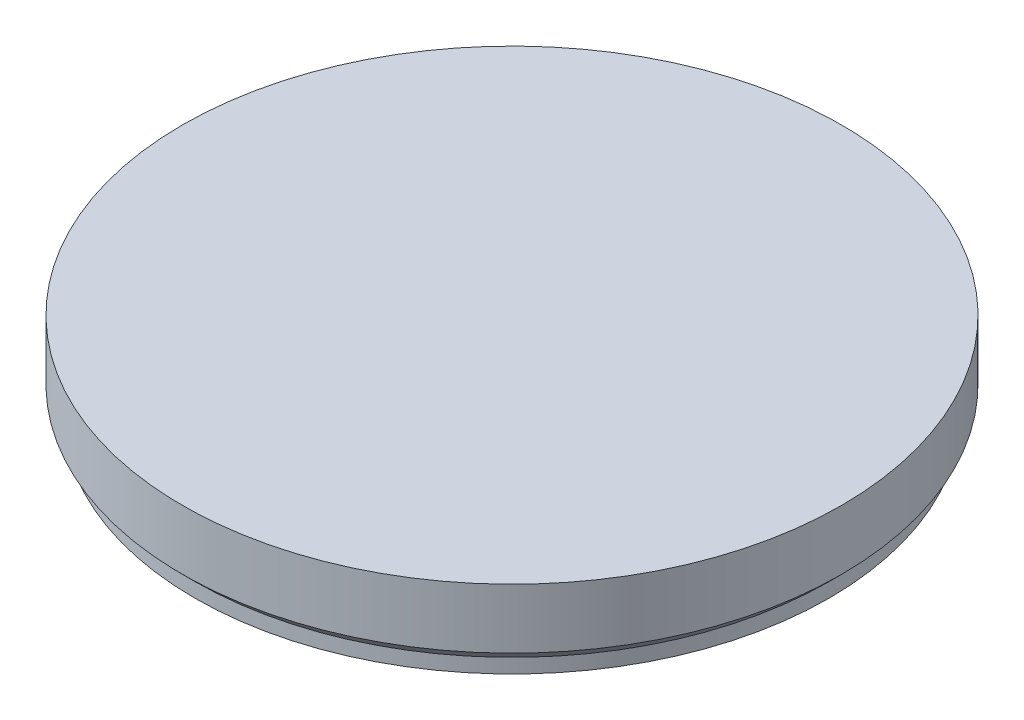
from build123d import *

# Parameters (mm, degrees)
SKETCH2_R            = 71
BOSS_EXTRUDE1_DEPTH  = 11
SKETCH12_R           = 57.5
SKETCH12_R_2         = 23.75
CUT_EXTRUDE8_DEPTH   = 1
CUT_EXTRUDE9_START   = -10
SKETCH10_R           = 85
SKETCH10_R_2         = 81
CUT_EXTRUDE9_DEPTH   = 10
SKETCH14_R           = 57.5
SKETCH14_R_2         = 23.75
BOSS_EXTRUDE2_DEPTH  = 1
SKETCH15_R           = 81
BOSS_EXTRUDE3_DEPTH  = 4
SKETCH16_R           = 57.5
SKETCH16_R_2         = 23.75
CUT_EXTRUDE11_DEPTH  = 2
SKETCH17_W           = 29
SKETCH17_H           = 10.11
SKETCH17_H_2         = 35.11
BOSS_EXTRUDE4_DEPTH  = 3
SKETCH19_R           = 80.970867582
BOSS_EXTRUDE5_DEPTH  = 2
BOSS_EXTRUDE6_START  = -3
SKETCH20_R           = 80.970867582
BOSS_EXTRUDE6_DEPTH  = 3
SKETCH21_W           = 29
SKETCH21_H           = 45.22
BOSS_EXTRUDE7_DEPTH  = 4
BOSS_EXTRUDE9_DEPTH  = 5
CUT_EXTRUDE12_START  = -5
SKETCH26_R           = 80.970867582
CUT_EXTRUDE12_DEPTH  = 5
BOSS_EXTRUDE10_START = -4
SKETCH27_R           = 80.970867582
BOSS_EXTRUDE10_DEPTH = 4
CUT_EXTRUDE15_REACH  = 120.043
SKETCH28_R           = 80.970867582
SKETCH28_R_2         = 80


with BuildPart() as part:
    # Sketch1 → Revolve1 (revolve)
    with BuildSketch(Plane.XY, mode=Mode.PRIVATE) as revolve1_sk:
        Polygon((0, 12), (0, 15), (85, 15), (85, 10.5), (84, 10.5), (77, 3.5), (77, 0), (71, 0), (71, 12), (23.75, 12), (23.75, -7.5), (21.25, -7.5), (21.25, 6), (6.5, 6), (6.5, 9), (0, 9), align=None)
    revolve(revolve1_sk.sketch.rotate(Axis((0, 12, 0), (0, -1, 0)), 180), axis=Axis((0, 12, 0), (0, -1, 0)))

    # Sketch2 → Boss-Extrude1 (add)
    with BuildSketch(Plane.XZ.offset(-12)):
        with Locations(Location((0, 0, 0), (0, 0, 180))):
            Circle(SKETCH2_R)
        Polygon((0, 70.292395274), (-60.875, 35.146197637), (-60.875, -35.146197637), (0, -70.292395274), (60.875, -35.146197637), (60.875, 35.146197637), align=None, mode=Mode.SUBTRACT)
    extrude(amount=BOSS_EXTRUDE1_DEPTH)

    # Sketch12 → Cut-Extrude8 (cut)
    with BuildSketch(Plane.XZ.offset(-12)):
        Circle(SKETCH12_R)
        with Locations(Location((0, 0, 0), (0, 0, 180))):
            Circle(SKETCH12_R_2, mode=Mode.SUBTRACT)
    extrude(amount=-CUT_EXTRUDE8_DEPTH, mode=Mode.SUBTRACT)

    # Sketch10 → Cut-Extrude9 (cut)
    with BuildSketch(Plane(origin=(0, 15, 0), x_dir=(1, 0, 0), z_dir=(0, 1, 0)).offset(CUT_EXTRUDE9_START)):
        Circle(SKETCH10_R)
        with Locations(Location((0, 0, 0), (0, 0, 180))):
            Circle(SKETCH10_R_2, mode=Mode.SUBTRACT)
    extrude(amount=CUT_EXTRUDE9_DEPTH, mode=Mode.SUBTRACT)

    # Sketch14 → Boss-Extrude2 (add)
    with BuildSketch(Plane(origin=(0, 13, 0), x_dir=(-1, 0, 0), z_dir=(0, -1, 0))):
        with Locations(Location((0, 0, 0), (0, 0, 180))):
            Circle(SKETCH14_R)
        Circle(SKETCH14_R_2, mode=Mode.SUBTRACT)
    extrude(amount=-BOSS_EXTRUDE2_DEPTH)

    # Sketch15 → Boss-Extrude3 (add)
    with BuildSketch(Plane(origin=(0, 15, 0), x_dir=(1, 0, 0), z_dir=(0, 1, 0))):
        with Locations(Location((0, 0, 0), (0, 0, 180))):
            Circle(SKETCH15_R)
    extrude(amount=BOSS_EXTRUDE3_DEPTH)

    # Sketch16 → Cut-Extrude11 (cut)
    with BuildSketch(Plane.XZ.offset(-13)):
        Circle(SKETCH16_R)
        with Locations(Location((0, 0, 0), (0, 0, 180))):
            Circle(SKETCH16_R_2, mode=Mode.SUBTRACT)
    extrude(amount=-CUT_EXTRUDE11_DEPTH, mode=Mode.SUBTRACT)

    # Sketch17 → Boss-Extrude4 (add)
    with BuildSketch(Plane(origin=(0, 19, 0), x_dir=(1, 0, 0), z_dir=(0, 1, 0))):
        with Locations((-48.833648901, -5.055)):
            Rectangle(SKETCH17_W, SKETCH17_H)
        with Locations((-48.833648901, 17.555)):
            Rectangle(SKETCH17_W, SKETCH17_H_2)
        with Locations((48.416351099, -5.055)):
            Rectangle(SKETCH17_W, SKETCH17_H)
        with Locations((48.416351099, 17.555)):
            Rectangle(SKETCH17_W, SKETCH17_H_2)
    extrude(amount=BOSS_EXTRUDE4_DEPTH)

    # Sketch19 → Boss-Extrude5 (add)
    with BuildSketch(Plane(origin=(0, 19, 0), x_dir=(1, 0, 0), z_dir=(0, 1, 0))):
        with Locations(Location((0, 0, 0), (0, 0, 180))):
            Circle(SKETCH19_R)
    extrude(amount=BOSS_EXTRUDE5_DEPTH)

    # Sketch20 → Boss-Extrude6 (add)
    with BuildSketch(Plane(origin=(0, 21, 0), x_dir=(1, 0, 0), z_dir=(0, 1, 0)).offset(BOSS_EXTRUDE6_START)):
        with Locations(Location((0, 0, 0), (0, 0, 180))):
            Circle(SKETCH20_R)
    extrude(amount=BOSS_EXTRUDE6_DEPTH)

    # Sketch21 → Boss-Extrude7 (add)
    with BuildSketch(Plane(origin=(0, 22, 0), x_dir=(1, 0, 0), z_dir=(0, 1, 0))):
        with Locations((48.416351099, 12.5)):
            Rectangle(SKETCH21_W, SKETCH21_H)
        with Locations((-48.833648901, 12.5)):
            Rectangle(SKETCH21_W, SKETCH21_H)
    extrude(amount=BOSS_EXTRUDE7_DEPTH)

    # Sketch22 → Boss-Extrude9 (add)
    with BuildSketch(Plane(origin=(0, 21, 0), x_dir=(1, 0, 0), z_dir=(0, 1, 0))):
        Polygon((48.416351099, 35.11), (37.416351099, 35.11), (37.416351099, 50.11), (59.416351099, 50.11), (59.416351099, 35.11), align=None)
    extrude(amount=BOSS_EXTRUDE9_DEPTH)

    # Sketch26 → Cut-Extrude12 (cut)
    with BuildSketch(Plane(origin=(0, 26, 0), x_dir=(1, 0, 0), z_dir=(0, 1, 0)).offset(CUT_EXTRUDE12_START)):
        with Locations(Location((0, 0, 0), (0, 0, 180))):
            Circle(SKETCH26_R)
    extrude(amount=CUT_EXTRUDE12_DEPTH, mode=Mode.SUBTRACT)

    # Sketch27 → Boss-Extrude10 (add)
    with BuildSketch(Plane(origin=(0, 21, 0), x_dir=(1, 0, 0), z_dir=(0, 1, 0)).offset(BOSS_EXTRUDE10_START)):
        with Locations(Location((0, 0, 0), (0, 0, 180))):
            Circle(SKETCH27_R)
    extrude(amount=BOSS_EXTRUDE10_DEPTH)

    # Cut-Extrude15: up to this cone (the profile starts inside it)
    cut_extrude15_end = Plane(origin=(0, 21, 0), z_dir=(0, 1, 0)).offset(-94.499999) * Cone(1e-06, 309.543, 309.542999, align=(Align.CENTER, Align.CENTER, Align.MIN), mode=Mode.PRIVATE)
    # Sketch28 → Cut-Extrude15 (cut, up to the surface)
    with BuildSketch(Plane(origin=(0, 21, 0), x_dir=(1, 0, 0), z_dir=(0, 1, 0)), mode=Mode.PRIVATE) as cut_extrude15_sk1:
        Circle(SKETCH28_R)
        with Locations(Location((0, 0, 0), (0, 0, 180))):
            Circle(SKETCH28_R_2, mode=Mode.SUBTRACT)
    cut_extrude15_tool1 = extrude(cut_extrude15_sk1.sketch, amount=-CUT_EXTRUDE15_REACH, mode=Mode.PRIVATE) & cut_extrude15_end
    add(cut_extrude15_tool1.solids().sort_by_distance((-80.741847, 21, 0))[0], mode=Mode.SUBTRACT)


with BuildPart() as body_2:
    # of the pieces the cut leaves, the one that is kept (cut_extrude15_keep)
    add(part.part.solids().sort_by_distance((-80, 6.5, 0))[0])


solid = body_2.part
